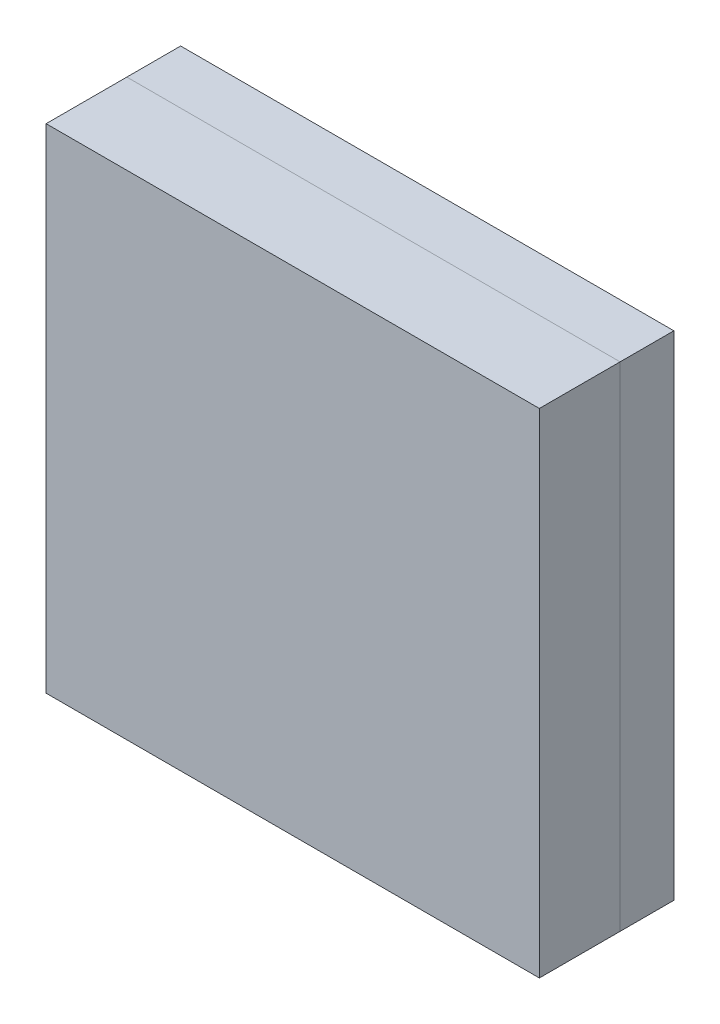
from build123d import *

# Parameters (mm, degrees)
SKETCH_2_W          = 5.5
SKETCH_2_H          = 5.5
SKETCH_2_W_2        = 4.5
SKETCH_2_H_2        = 4.5
EXTRUDE_2_DEPTH     = 0.8
SKETCH_3_W          = 5.5
SKETCH_3_H          = 5.5
EXTRUDE_3_DEPTH     = 0.2
SKETCH_10_W         = 5.5
SKETCH_10_H         = 5.5
CUT_EXTRUDE_1_DEPTH = 0.3
SKETCH_13_W         = 5.5
SKETCH_13_H         = 5.5
EXTRUDE_7_DEPTH     = 0.2
SKETCH_12_W         = 4.5
SKETCH_12_H         = 1.5
SKETCH_12_W_2       = 1.5
SKETCH_12_H_2       = 4.5
EXTRUDE_3_2_DEPTH   = 0.7
SKETCH_14_W         = 5.5
SKETCH_14_H         = 5.5
EXTRUDE_8_DEPTH     = 0.6
SKETCH_15_W         = 0.5
SKETCH_15_H         = 4.5
EXTRUDE_4_DEPTH     = 4.5


with BuildPart() as part:
    # 草图2 → Extrude 2 (new body)
    with BuildSketch(Plane.XY):
        with Locations((2.75, 2.75)):
            Rectangle(SKETCH_2_W, SKETCH_2_H)
        with Locations((2.75, 2.75)):
            Rectangle(SKETCH_2_W_2, SKETCH_2_H_2, mode=Mode.SUBTRACT)
    extrude(amount=EXTRUDE_2_DEPTH)

    # 草图3 → Extrude 3 (add)
    with BuildSketch(Plane.XY.offset(0.8)):
        with Locations((2.75, 2.75)):
            Rectangle(SKETCH_3_W, SKETCH_3_H)
    extrude(amount=EXTRUDE_3_DEPTH)

    # 草图10 → 切除-拉伸1 (cut)
    with BuildSketch(Plane.XY.offset(1)):
        with Locations((2.75, 2.75)):
            Rectangle(SKETCH_10_W, SKETCH_10_H)
    extrude(amount=-CUT_EXTRUDE_1_DEPTH, mode=Mode.SUBTRACT)

    # 草图13 → 凸台-拉伸7 (add)
    with BuildSketch(Plane.XY.offset(0.7)):
        with Locations((2.75, 2.75)):
            Rectangle(SKETCH_13_W, SKETCH_13_H)
    extrude(amount=EXTRUDE_7_DEPTH)

    # 草图12 → Extrude 3 2 (add)
    with BuildSketch(Plane(origin=(0, 0, 0), x_dir=(-1, 0, 0), z_dir=(0, 0, -1))):
        with Locations((-2.75, 2.75)):
            Rectangle(SKETCH_12_W, SKETCH_12_H)
        with Locations((-2.75, 2.75)):
            Rectangle(SKETCH_12_W_2, SKETCH_12_H_2)
    extrude(amount=-EXTRUDE_3_2_DEPTH)

    # 草图15 → Extrude 4 (add)
    with BuildSketch(Plane.ZY.offset(-5)):
        with Locations((0.35, 2.75)):
            Rectangle(SKETCH_15_W, SKETCH_15_H)
    extrude(amount=EXTRUDE_4_DEPTH)


with BuildPart() as body_2:
    # 草图14 → 凸台-拉伸8 (new body)
    with BuildSketch(Plane(origin=(0, 0, 0), x_dir=(-1, 0, 0), z_dir=(0, 0, -1))):
        with Locations((-2.75, 2.75)):
            Rectangle(SKETCH_14_W, SKETCH_14_H)
    extrude(amount=EXTRUDE_8_DEPTH)


solid = Compound([part.part, body_2.part])
